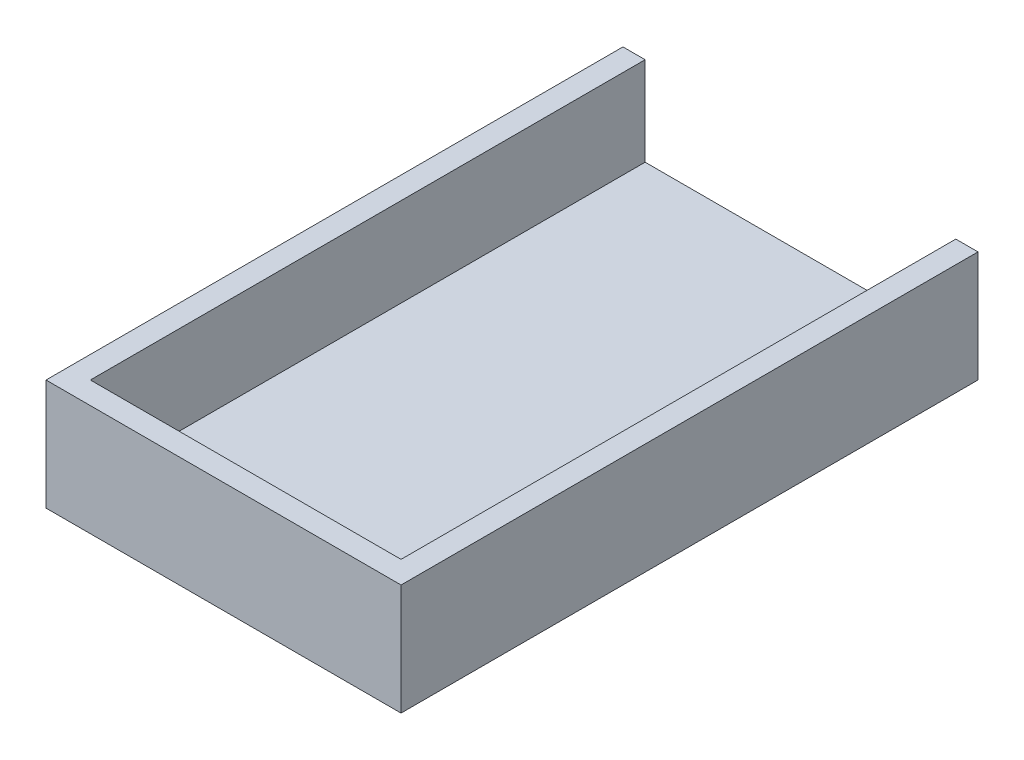
from build123d import *

# Parameters (mm, degrees)
SKETCH_1_W          = 16
SKETCH_1_H          = 26
EXTRUDE_1_DEPTH     = 5
CUT_EXTRUDE_START   = 1
SKETCH_2_W          = 14
SKETCH_2_H          = 25
CUT_EXTRUDE_1_DEPTH = 10
EXTRUDE_START       = 5
SKETCH_3_W          = 16
SKETCH_3_H          = 26
EXTRUDE_3_DEPTH     = 1
CUT_EXTRUDE_START_2 = 6
SKETCH_4_W          = 14
SKETCH_4_H          = 17
CUT_EXTRUDE_2_DEPTH = 1
SKETCH_5_W          = 16
SKETCH_5_H          = 26
CUT_EXTRUDE_3_DEPTH = 1


with BuildPart() as part:
    # 스케치1 → 보스-돌출1 (new body)
    with BuildSketch(Plane(origin=(0, 0, 0), x_dir=(1, 0, 0), z_dir=(0, 1, 0))):
        Rectangle(SKETCH_1_W, SKETCH_1_H)
    extrude(amount=EXTRUDE_1_DEPTH)

    # 스케치2 → 컷-돌출1 (cut)
    with BuildSketch(Plane(origin=(0, 0, 0), x_dir=(1, 0, 0), z_dir=(0, 1, 0)).offset(CUT_EXTRUDE_START)):
        with Locations((0, 0.5)):
            Rectangle(SKETCH_2_W, SKETCH_2_H)
    extrude(amount=CUT_EXTRUDE_1_DEPTH, mode=Mode.SUBTRACT)


with BuildPart() as body_2:
    # 스케치3 → 보스-돌출3 (new body)
    with BuildSketch(Plane(origin=(0, 0, 0), x_dir=(1, 0, 0), z_dir=(0, 1, 0)).offset(EXTRUDE_START)):
        Rectangle(SKETCH_3_W, SKETCH_3_H)
    extrude(amount=EXTRUDE_3_DEPTH)

    # 스케치4 → 컷-돌출2 (cut)
    with BuildSketch(Plane(origin=(0, 0, 0), x_dir=(1, 0, 0), z_dir=(0, 1, 0)).offset(CUT_EXTRUDE_START_2)):
        with Locations((0, -1.5)):
            Rectangle(SKETCH_4_W, SKETCH_4_H)
    extrude(amount=-CUT_EXTRUDE_2_DEPTH, mode=Mode.SUBTRACT)

    # 스케치5 → 컷-돌출3 (cut)
    with BuildSketch(Plane(origin=(0, 6, 0), x_dir=(1, 0, 0), z_dir=(0, 1, 0))):
        Rectangle(SKETCH_5_W, SKETCH_5_H)
    extrude(amount=-CUT_EXTRUDE_3_DEPTH, mode=Mode.SUBTRACT)


solid = part.part
